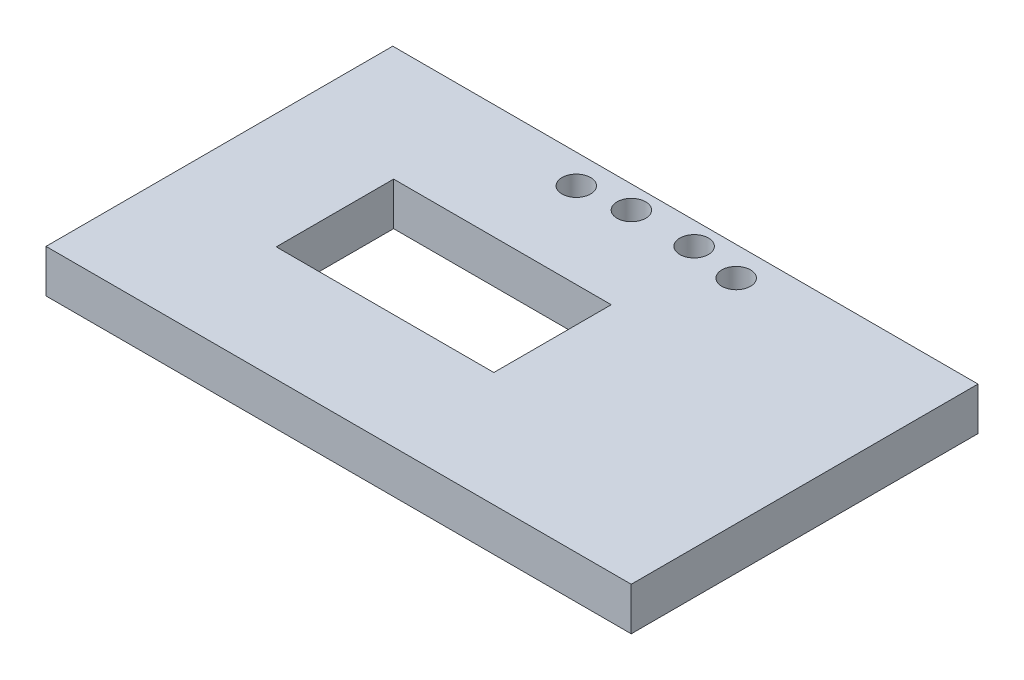
from build123d import *

# Parameters (mm, degrees)
SKETCH1_W           = 61.316073308
SKETCH1_H           = 36.331769478
SKETCH1_R           = 1.5
SKETCH1_W_2         = 22.8
SKETCH1_H_2         = 12.3
BOSS_EXTRUDE1_DEPTH = 4.5


with BuildPart() as part:
    # Sketch1 → Boss-Extrude1 (new body)
    with BuildSketch(Plane(origin=(0, 0, 0), x_dir=(1, 0, 0), z_dir=(0, 1, 0))):
        Rectangle(SKETCH1_W, SKETCH1_H)
        with Locations(Location((-8.375566803, 15.111963379, 0), (0, 0, 270))):
            Circle(SKETCH1_R, mode=Mode.SUBTRACT)
        with Locations(Location((-3.28811928, 15.796049513, 0), (0, 0, 270))):
            Circle(SKETCH1_R, mode=Mode.SUBTRACT)
        with Locations(Location((3.28811928, 15.796049513, 0), (0, 0, 90))):
            Circle(SKETCH1_R, mode=Mode.SUBTRACT)
        with Locations(Location((8.375566803, 15.111963379, 0), (0, 0, 90))):
            Circle(SKETCH1_R, mode=Mode.SUBTRACT)
        with Locations((-7.152117885, 0)):
            Rectangle(SKETCH1_W_2, SKETCH1_H_2, mode=Mode.SUBTRACT)
    extrude(amount=BOSS_EXTRUDE1_DEPTH)


solid = part.part
